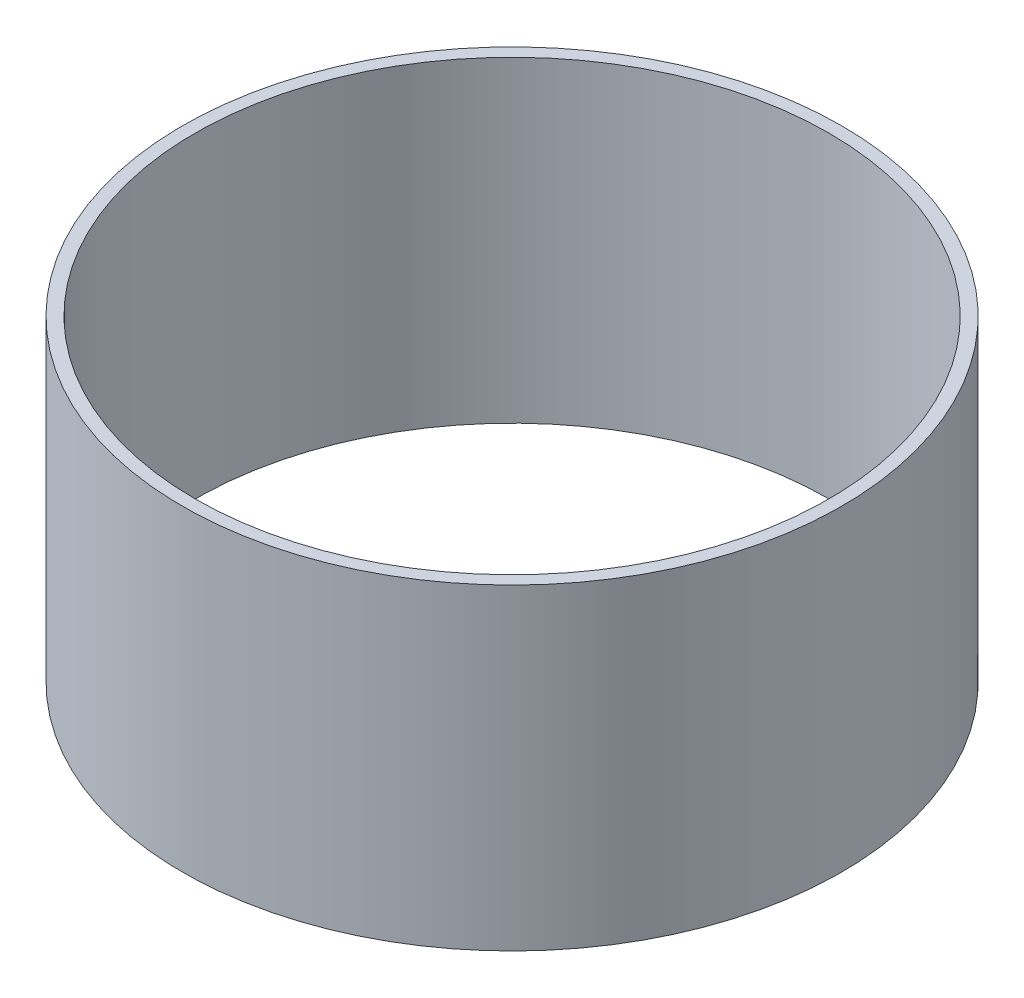
from build123d import *

# Parameters (mm, degrees)
SKETCH1_R           = 39.624
SKETCH1_R_2         = 38.1
BOSS_EXTRUDE1_DEPTH = 38.1


with BuildPart() as part:
    # Sketch1 → Boss-Extrude1 (new body)
    with BuildSketch(Plane(origin=(0, 0, 0), x_dir=(1, 0, 0), z_dir=(0, 1, 0))):
        with Locations(Location((0, 0, 0), (0, 0, 90))):
            Circle(SKETCH1_R)
        with Locations(Location((0, 0, 0), (0, 0, 90))):
            Circle(SKETCH1_R_2, mode=Mode.SUBTRACT)
    extrude(amount=BOSS_EXTRUDE1_DEPTH)


solid = part.part
